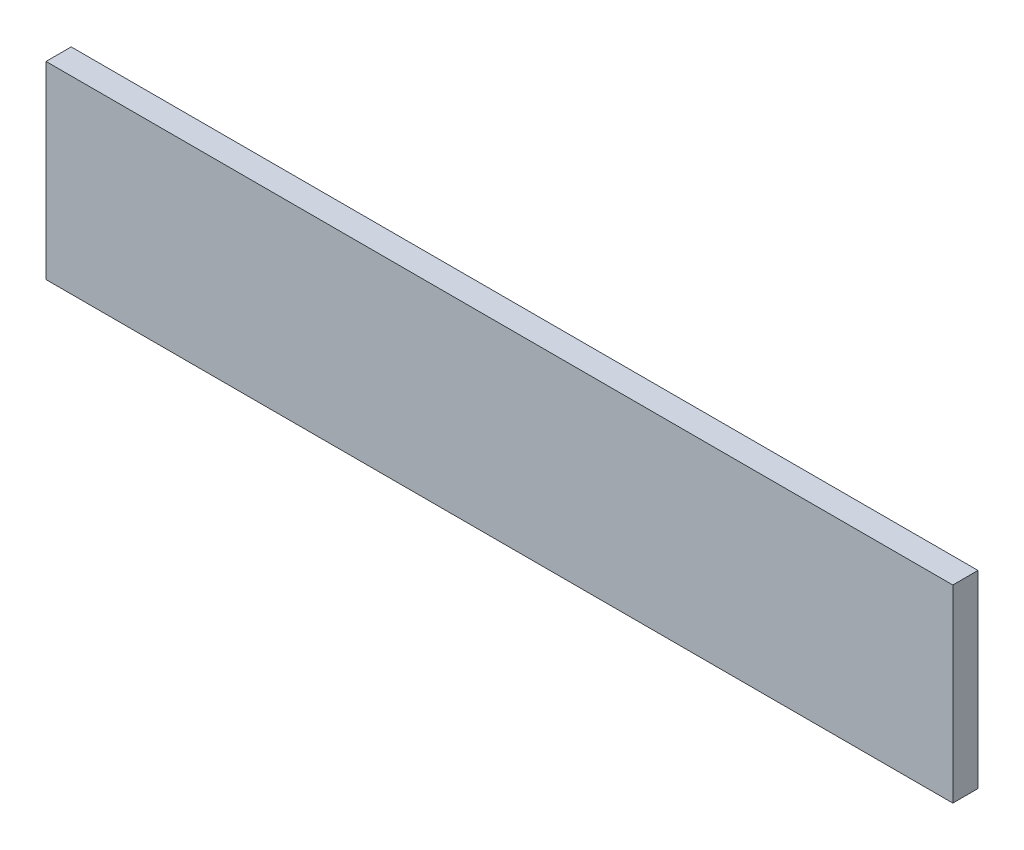
from build123d import *

# Parameters (mm, degrees)
SKETCH1_W           = 72
SKETCH1_H           = 15
BOSS_EXTRUDE1_DEPTH = 2


with BuildPart() as part:
    # Sketch1 → Boss-Extrude1 (new body)
    with BuildSketch(Plane.XY):
        Rectangle(SKETCH1_W, SKETCH1_H)
    extrude(amount=BOSS_EXTRUDE1_DEPTH)


solid = part.part
